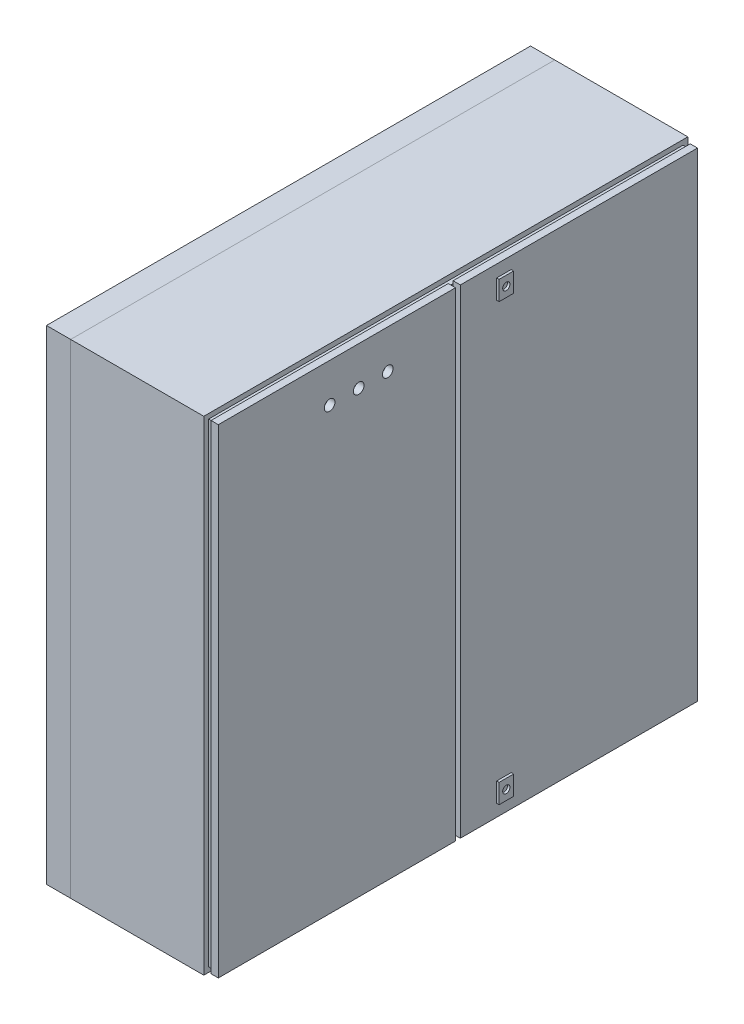
from build123d import *

# Parameters (mm, degrees)
SKETCH1_W             = 1000
SKETCH1_H             = 1000
BOSS_EXTRUDE1_DEPTH   = 275
BOSS_EXTRUDE2_START   = 10
SKETCH2_W             = 490
SKETCH2_H             = 990
BOSS_EXTRUDE2_DEPTH   = 15
BOSS_EXTRUDE2_2_DEPTH = 15
SKETCH3_W             = 980
SKETCH3_H             = 980
SKETCH3_W_2           = 960
SKETCH3_H_2           = 960
BOSS_EXTRUDE3_DEPTH   = 10
SKETCH4_W             = 1000
SKETCH4_H             = 1000
SKETCH4_W_2           = 900
SKETCH4_H_2           = 900
BOSS_EXTRUDE4_DEPTH   = 50
SKETCH5_R             = 11
CUT_EXTRUDE1_DEPTH    = 25
SKETCH6_W             = 30
SKETCH6_H             = 40
SKETCH6_R             = 7.5
BOSS_EXTRUDE5_DEPTH   = 5
BOSS_EXTRUDE5_2_DEPTH = 5


with BuildPart() as part:
    # Sketch1 → Boss-Extrude1 (new body)
    with BuildSketch(Plane(origin=(0, 0, 0), x_dir=(0, 0, -1), z_dir=(1, 0, 0))):
        Rectangle(SKETCH1_W, SKETCH1_H)
    extrude(amount=BOSS_EXTRUDE1_DEPTH)

    # Sketch3 → Boss-Extrude3 (add)
    with BuildSketch(Plane(origin=(275, 0, 0), x_dir=(0, 0, -1), z_dir=(1, 0, 0))):
        Rectangle(SKETCH3_W, SKETCH3_H)
        Rectangle(SKETCH3_W_2, SKETCH3_H_2, mode=Mode.SUBTRACT)
    extrude(amount=BOSS_EXTRUDE3_DEPTH)


with BuildPart() as body_2:
    # Sketch2 → Boss-Extrude2 (new body)
    with BuildSketch(Plane(origin=(275, 0, 0), x_dir=(0, 0, -1), z_dir=(1, 0, 0)).offset(BOSS_EXTRUDE2_START)):
        with Locations((-250, 0)):
            Rectangle(SKETCH2_W, SKETCH2_H)
    extrude(amount=BOSS_EXTRUDE2_DEPTH)

    # Sketch5 → Cut-Extrude1 (cut)
    with BuildSketch(Plane(origin=(300, 0, 0), x_dir=(0, 0, -1), z_dir=(1, 0, 0))):
        with Locations((-265, 415)):
            Circle(SKETCH5_R)
        with Locations((-205, 415)):
            Circle(SKETCH5_R)
        with Locations((-145, 415)):
            Circle(SKETCH5_R)
    extrude(amount=-CUT_EXTRUDE1_DEPTH, mode=Mode.SUBTRACT)


with BuildPart() as body_3:
    # Sketch2 → Boss-Extrude2 2 (new body)
    with BuildSketch(Plane(origin=(275, 0, 0), x_dir=(0, 0, -1), z_dir=(1, 0, 0)).offset(BOSS_EXTRUDE2_START)):
        with Locations((250, 0)):
            Rectangle(SKETCH2_W, SKETCH2_H)
    extrude(amount=BOSS_EXTRUDE2_2_DEPTH)


with BuildPart() as body_4:
    # Sketch4 → Boss-Extrude4 (new body)
    with BuildSketch(Plane.ZY):
        Rectangle(SKETCH4_W, SKETCH4_H)
        Rectangle(SKETCH4_W_2, SKETCH4_H_2, mode=Mode.SUBTRACT)
    extrude(amount=BOSS_EXTRUDE4_DEPTH)


with BuildPart() as body_5:
    # Sketch6 → Boss-Extrude5 (new body)
    with BuildSketch(Plane(origin=(300, 0, 0), x_dir=(0, 0, -1), z_dir=(1, 0, 0))):
        with Locations((95, 450)):
            Rectangle(SKETCH6_W, SKETCH6_H)
        with Locations((95, 450)):
            Circle(SKETCH6_R, mode=Mode.SUBTRACT)
    extrude(amount=BOSS_EXTRUDE5_DEPTH)


with BuildPart() as body_6:
    # Sketch6 → Boss-Extrude5 2 (new body)
    with BuildSketch(Plane(origin=(300, 0, 0), x_dir=(0, 0, -1), z_dir=(1, 0, 0))):
        with Locations((95, -450)):
            Rectangle(SKETCH6_W, SKETCH6_H)
        with Locations(Location((95, -450, 0), (0, 0, 180))):
            Circle(SKETCH6_R, mode=Mode.SUBTRACT)
    extrude(amount=BOSS_EXTRUDE5_2_DEPTH)


solid = Compound([part.part, body_2.part, body_3.part, body_4.part, body_5.part, body_6.part])
